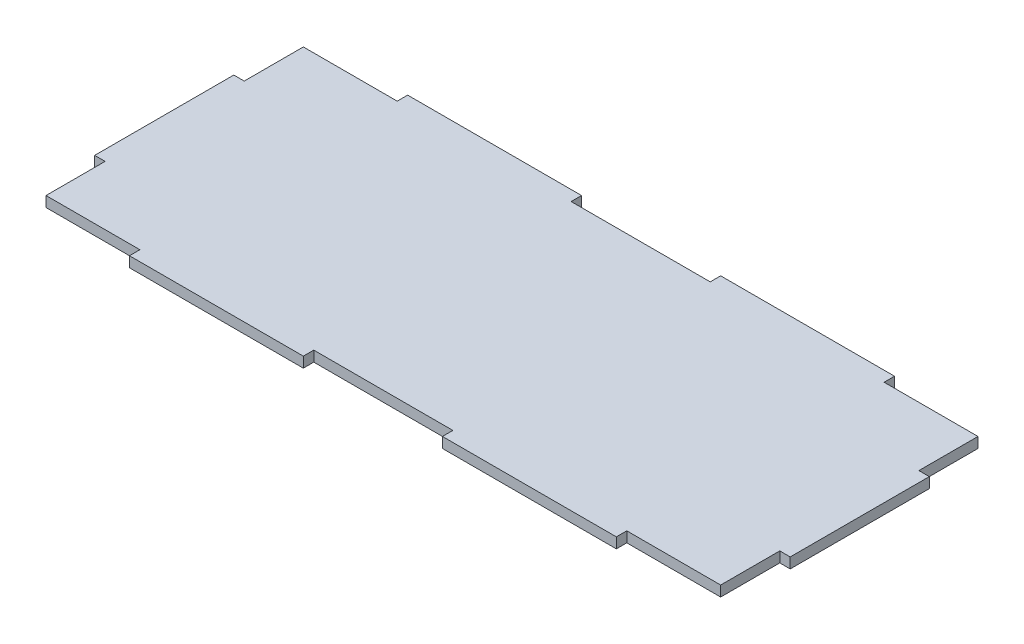
from build123d import *

# Parameters (mm, degrees)
BOSS_EXTRU_1_DEPTH = 3


with BuildPart() as part:
    # Esquisse1 → Boss.-Extru.1 (new body)
    with BuildSketch(Plane(origin=(0, 0, 0), x_dir=(1, 0, 0), z_dir=(0, 1, 0))):
        Polygon((-36.05381075, 28.513165436), (13.94618925, 28.513165436), (13.94618925, 25.513165436), (53.94618925, 25.513165436), (53.94618925, 28.513165436), (103.94618925, 28.513165436), (103.94618925, 25.513165436), (130.94618925, 25.513165436), (130.94618925, 8.513165436), (133.94618925, 8.513165436), (133.94618925, -31.486834564), (130.94618925, -31.486834564), (130.94618925, -48.486834564), (103.94618925, -48.486834564), (103.94618925, -51.486834564), (53.94618925, -51.486834564), (53.94618925, -48.486834564), (13.94618925, -48.486834564), (13.94618925, -51.486834564), (-36.05381075, -51.486834564), (-36.05381075, -48.486834564), (-63.05381075, -48.486834564), (-63.05381075, -31.486834564), (-66.05381075, -31.486834564), (-66.05381075, 8.513165436), (-63.05381075, 8.513165436), (-63.05381075, 25.513165436), (-36.05381075, 25.513165436), align=None)
    extrude(amount=BOSS_EXTRU_1_DEPTH)


solid = part.part
